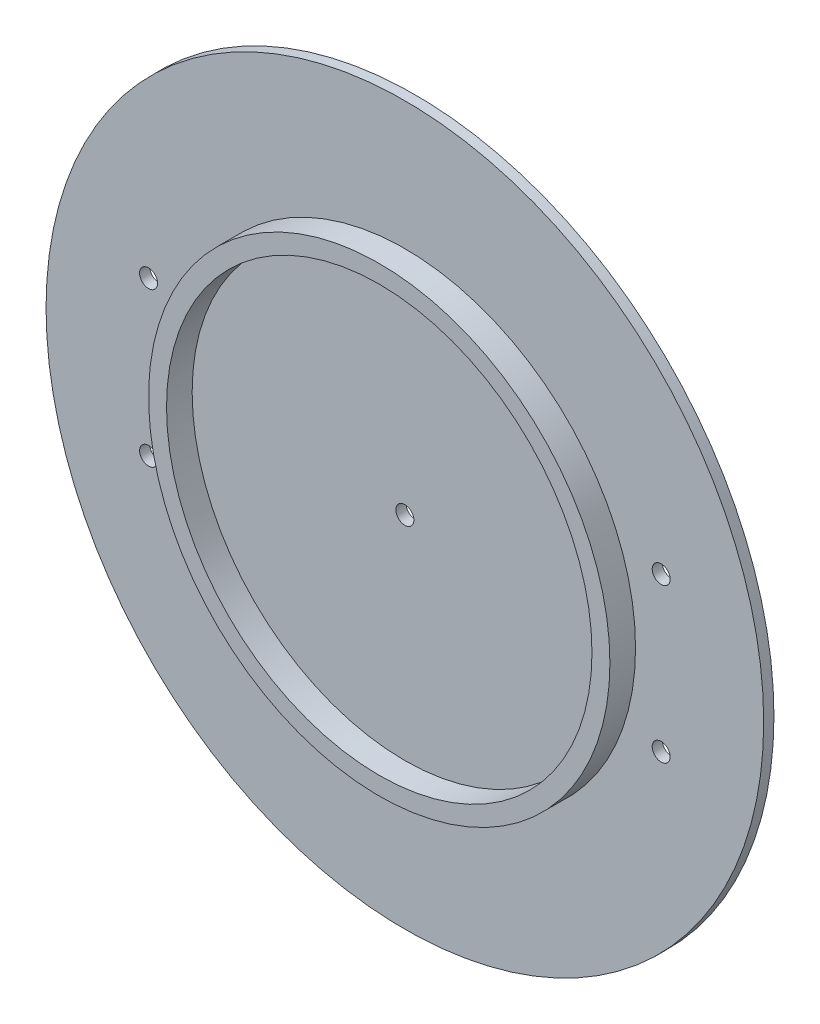
from build123d import *

# Parameters (mm, degrees)
SKETCH1_R           = 70
BOSS_EXTRUDE1_DEPTH = 2
SKETCH2_R           = 1.75
CUT_EXTRUDE1_DEPTH  = 100.015150356
SKETCH4_R           = 45
SKETCH4_R_2         = 41.5
BOSS_EXTRUDE2_DEPTH = 5


with BuildPart() as part:
    # Sketch1 → Boss-Extrude1 (new body)
    with BuildSketch(Plane.XY):
        Circle(SKETCH1_R)
    extrude(amount=BOSS_EXTRUDE1_DEPTH)

    # Sketch2 → Cut-Extrude1 (cut, through all)
    with BuildSketch(Plane.XY.offset(2)):
        with Locations((-50, 15)):
            Circle(SKETCH2_R)
        with Locations((50, 15)):
            Circle(SKETCH2_R)
        with Locations((50, -15)):
            Circle(SKETCH2_R)
        with Locations((-50, -15)):
            Circle(SKETCH2_R)
        Circle(SKETCH2_R)
    extrude(amount=-CUT_EXTRUDE1_DEPTH, mode=Mode.SUBTRACT)

    # Sketch4 → Boss-Extrude2 (add)
    with BuildSketch(Plane.XY.offset(2)):
        Circle(SKETCH4_R)
        Circle(SKETCH4_R_2, mode=Mode.SUBTRACT)
    extrude(amount=BOSS_EXTRUDE2_DEPTH)


solid = part.part
